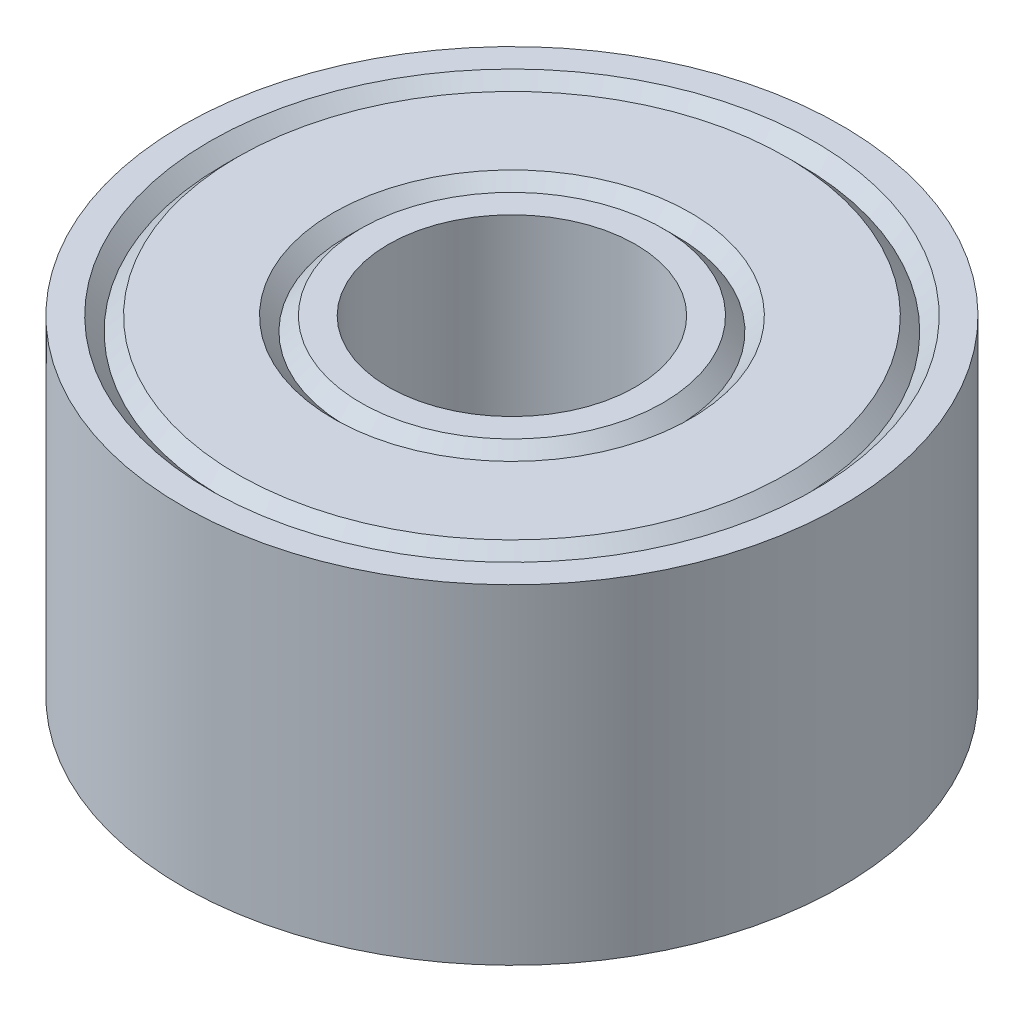
from build123d import *


with BuildPart() as part:
    # Sketch1 → Revolve1 (revolve)
    with BuildSketch(Plane.XY):
        Polygon((-1.5, 2), (-1.833333333, 2), (-2, 1.833333333), (-2.166666667, 2), (-3.333333333, 2), (-3.5, 1.833333333), (-3.666666667, 2), (-4, 2), (-4, -2), (-3.666666667, -2), (-3.5, -1.833333333), (-3.333333333, -2), (-2.166666667, -2), (-2, -1.833333333), (-1.833333333, -2), (-1.5, -2), align=None)
    revolve(axis=Axis((0, 2, 0), (0, -1, 0)))


solid = part.part
